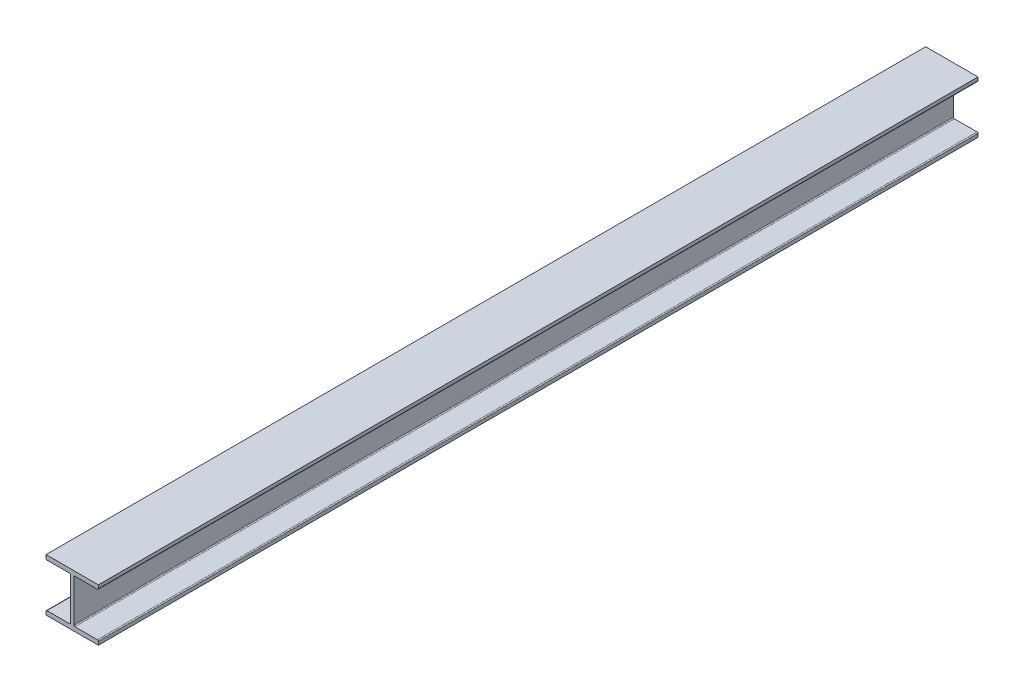
from build123d import *

# Parameters (mm, degrees)
BOSS_EXTRUDE1_DEPTH = 2133.6
SKETCH2_W           = 19.05
SKETCH2_H           = 19.05
CUT_EXTRUDE1_DEPTH  = 2136.489044692
FILLET1_R           = 2.54


with BuildPart() as part:
    # Sketch1 → Boss-Extrude1 (new body)
    with BuildSketch(Plane.XY):
        Polygon((-63.5, 63.5), (63.5, 63.5), (63.5, 53.0352), (23.0251, 53.0352), (23.0251, 33.9852), (3.9751, 33.9852), (3.9751, -53.0352), (63.5, -53.0352), (63.5, -63.5), (-63.5, -63.5), (-63.5, -53.0352), (-3.9751, -53.0352), (-3.9751, 33.9852), (-23.0251, 33.9852), (-23.0251, 53.0352), (-63.5, 53.0352), align=None)
    extrude(amount=BOSS_EXTRUDE1_DEPTH)

    # Sketch2 → Cut-Extrude1 (cut, through all)
    with BuildSketch(Plane.XY):
        with Locations((-13.5001, 43.5102)):
            Rectangle(SKETCH2_W, SKETCH2_H)
        with Locations((13.5001, 43.5102)):
            Rectangle(SKETCH2_W, SKETCH2_H)
    extrude(amount=CUT_EXTRUDE1_DEPTH, mode=Mode.SUBTRACT)

    # Fillet1
    fillet1_edges = [part.edges().sort_by_distance(p)[0] for p in [
        (-63.5, -53.0352, 1066.8),
        (-3.9751, -53.0352, 1066.8),
        (-63.5, 53.0352, 1066.8),
        (63.5, 53.0352, 1066.8),
        (3.9751, -53.0352, 1066.8),
        (63.5, -53.0352, 1066.8),
        (-3.9751, 53.0352, 1066.8),
        (3.9751, 53.0352, 1066.8),
    ]]
    fillet(fillet1_edges, radius=FILLET1_R)


solid = part.part
